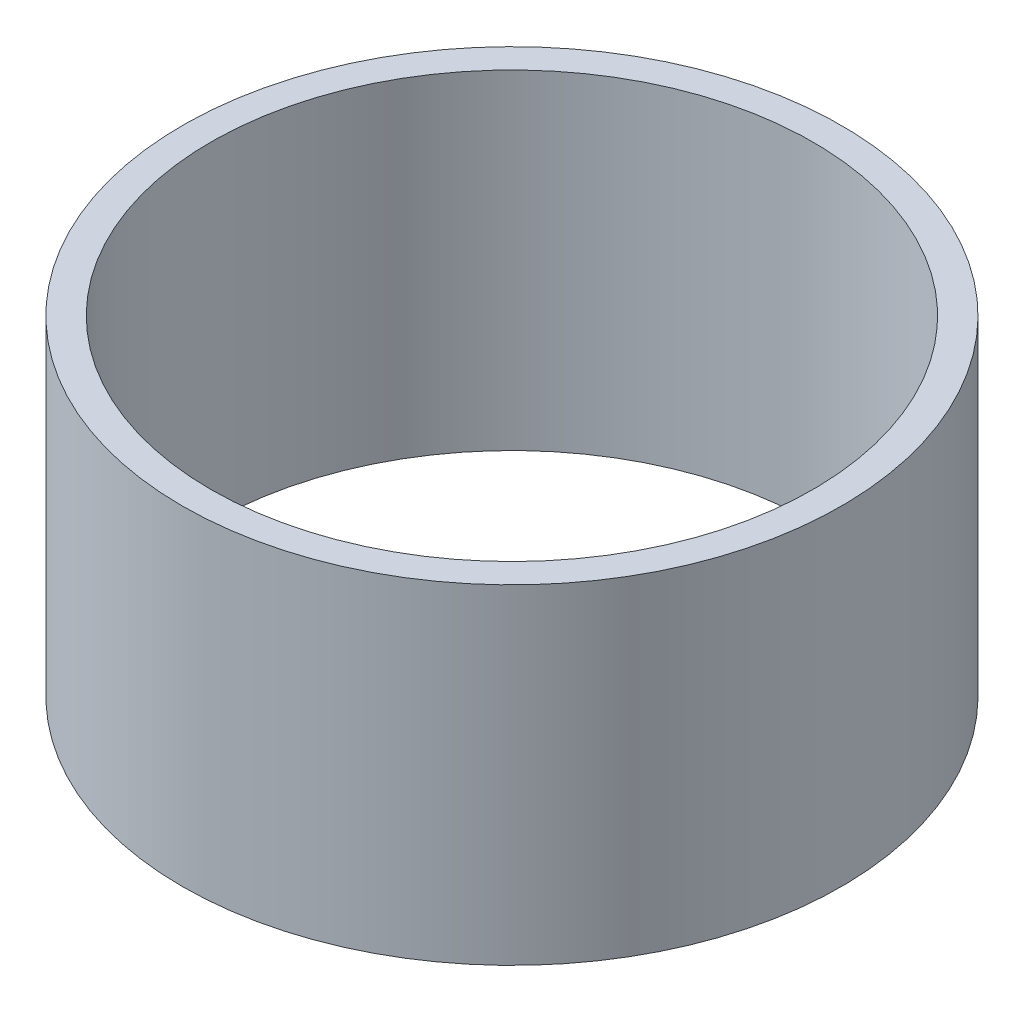
from build123d import *

# Parameters (mm, degrees)
EXTRUDE1_DEPTH          = 9.525
EXTRUDE1_DEPTH_BACK     = 9.525
SKETCH1_R               = 19.05
CUT_EXTRUDE1_DEPTH      = 29.575
CUT_EXTRUDE1_DEPTH_BACK = 29.575
SKETCH2_R               = 17.399


with BuildPart() as part:
    # Sketch1 → Extrude1 (new, two sides: drawn at the far end of the back side and taken through both)
    with BuildSketch(Plane(origin=(0, 0, 0), x_dir=(1, 0, 0), z_dir=(0, 1, 0)).offset(-EXTRUDE1_DEPTH_BACK)):
        Circle(SKETCH1_R)
    extrude(amount=EXTRUDE1_DEPTH + EXTRUDE1_DEPTH_BACK)

    # Sketch2 → Cut-Extrude1 (cut, two sides: drawn at the far end of the back side and taken through both)
    with BuildSketch(Plane(origin=(0, 0, 0), x_dir=(1, 0, 0), z_dir=(0, 1, 0)).offset(-CUT_EXTRUDE1_DEPTH_BACK)):
        Circle(SKETCH2_R)
    extrude(amount=CUT_EXTRUDE1_DEPTH + CUT_EXTRUDE1_DEPTH_BACK, mode=Mode.SUBTRACT)


solid = part.part
